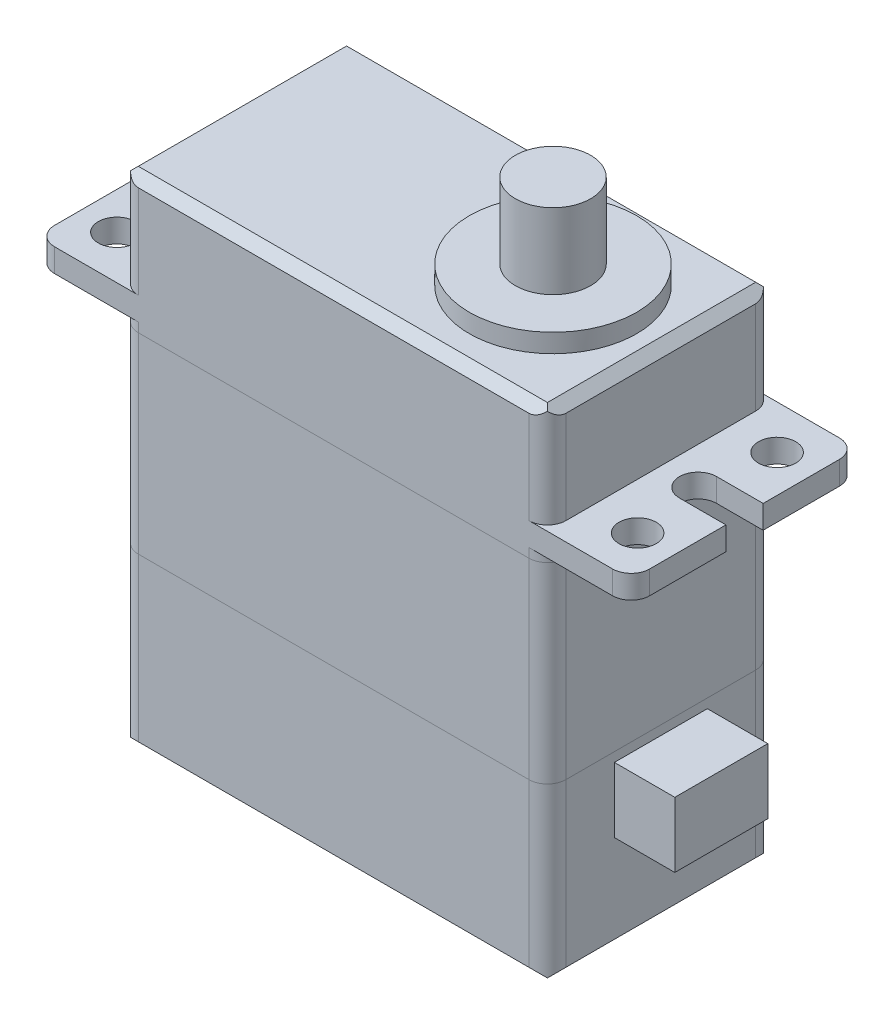
from build123d import *

# Parameters (mm, degrees)
ESQUISSE1_W             = 23
ESQUISSE1_H             = 26.8
BOSS_EXTRU_1_DEPTH      = 12.2
ESQUISSE2_W             = 32
ESQUISSE2_H             = 1.25
BOSS_EXTRU_2_DEPTH      = 12.2
ESQUISSE3_R             = 4.5
BOSS_EXTRU_3_DEPTH      = 1
ESQUISSE4_R             = 2.025
BOSS_EXTRU_4_DEPTH      = 4.05
ESQUISSE5_W             = 5
ESQUISSE5_H             = 3.5
BOSS_EXTRU_5_DEPTH      = 3.25
ESQUISSE7_R             = 1
ENL_V_MAT_EXTRU_1_DEPTH = 1.25
CHANFREIN1_SIZE         = 0.5
CONG_1_R                = 1
CONG_2_R                = 1


with BuildPart() as part:
    # Esquisse1 → Boss.-Extru.1 (new body)
    with BuildSketch(Plane.XY):
        with Locations((11.5, 13.4)):
            Rectangle(ESQUISSE1_W, ESQUISSE1_H)
    extrude(amount=BOSS_EXTRU_1_DEPTH)

    # Esquisse2 → Boss.-Extru.2 (add)
    with BuildSketch(Plane.XY.offset(12.2)):
        with Locations((11.5, 20.675)):
            Rectangle(ESQUISSE2_W, ESQUISSE2_H)
    extrude(amount=-BOSS_EXTRU_2_DEPTH)

    # Esquisse3 → Boss.-Extru.3 (add)
    with BuildSketch(Plane(origin=(0, 26.8, 0), x_dir=(1, 0, 0), z_dir=(0, 1, 0))):
        with Locations(Location((17.2, -6.1, 0), (0, 0, 90))):
            Circle(ESQUISSE3_R)
    extrude(amount=BOSS_EXTRU_3_DEPTH)

    # Esquisse4 → Boss.-Extru.4 (add)
    with BuildSketch(Plane(origin=(0, 27.8, 0), x_dir=(1, 0, 0), z_dir=(0, 1, 0))):
        with Locations(Location((17.2, -6.1, 0), (0, 0, 270))):
            Circle(ESQUISSE4_R)
    extrude(amount=BOSS_EXTRU_4_DEPTH)

    # Esquisse5 → Boss.-Extru.5 (add)
    with BuildSketch(Plane(origin=(23, 0, 0), x_dir=(0, 0, -1), z_dir=(1, 0, 0))):
        with Locations((-6.1, 6.99)):
            Rectangle(ESQUISSE5_W, ESQUISSE5_H)
    extrude(amount=BOSS_EXTRU_5_DEPTH)

    # Esquisse7 → Enlèv. mat.-Extru.1 (cut)
    with BuildSketch(Plane(origin=(0, 21.3, 0), x_dir=(1, 0, 0), z_dir=(0, 1, 0))):
        with Locations(Location((25.5, -2.35, 0), (0, 0, 180))):
            Circle(ESQUISSE7_R)
        with Locations(Location((25.5, -9.85, 0), (0, 0, 180))):
            Circle(ESQUISSE7_R)
        with Locations((-2.5, -9.85)):
            Circle(ESQUISSE7_R)
        with Locations((-2.5, -2.35)):
            Circle(ESQUISSE7_R)
        with BuildLine():
            Line((30, -7.1), (25, -7.1))
            ThreePointArc((25, -7.1), (24, -6.1), (25, -5.1))
            Line((25, -5.1), (30, -5.1))
            ThreePointArc((30, -5.1), (31, -6.1), (30, -7.1))
        make_face()
        with BuildLine():
            Line((-7, -5.1), (-2, -5.1))
            ThreePointArc((-2, -5.1), (-1, -6.1), (-2, -7.1))
            Line((-2, -7.1), (-7, -7.1))
            ThreePointArc((-7, -7.1), (-8, -6.1), (-7, -5.1))
        make_face()
    extrude(amount=-ENL_V_MAT_EXTRU_1_DEPTH, mode=Mode.SUBTRACT)

    # Chanfrein1
    chanfrein1_edges = [part.edges().sort_by_distance(p)[0] for p in [
        (11.5, 26.8, 12.2),
        (11.5, 26.8, 0),
        (11.5, 0, 0),
        (11.5, 0, 12.2),
        (0, 26.8, 6.1),
        (23, 26.8, 6.1),
        (23, 0, 6.1),
        (0, 0, 6.1),
    ]]
    chamfer(chanfrein1_edges, length=CHANFREIN1_SIZE)

    # Congé1
    cong_1_edges = [part.edges().sort_by_distance(p)[0] for p in [
        (23, 10.275, 12.2),
        (0, 10.275, 0),
        (23, 10.275, 0),
        (0, 23.8, 12.2),
        (23, 23.8, 0),
        (0, 23.8, 0),
        (0, 10.275, 12.2),
        (23, 23.8, 12.2),
        (23, 10.275, 0),
        (0, 10.275, 0),
        (23, 10.275, 12.2),
        (0, 10.275, 12.2),
        (0, 10.275, 0),
        (23, 10.275, 0),
        (23, 10.275, 12.2),
        (0, 10.275, 12.2),
    ]]
    fillet(cong_1_edges, radius=CONG_1_R)

    # Congé2
    cong_2_edges = [part.edges().sort_by_distance(p)[0] for p in [
        (-4.5, 20.675, 12.2),
        (27.5, 20.675, 12.2),
        (27.5, 20.675, 0),
        (-4.5, 20.675, 0),
    ]]
    fillet(cong_2_edges, radius=CONG_2_R)


solid = part.part
